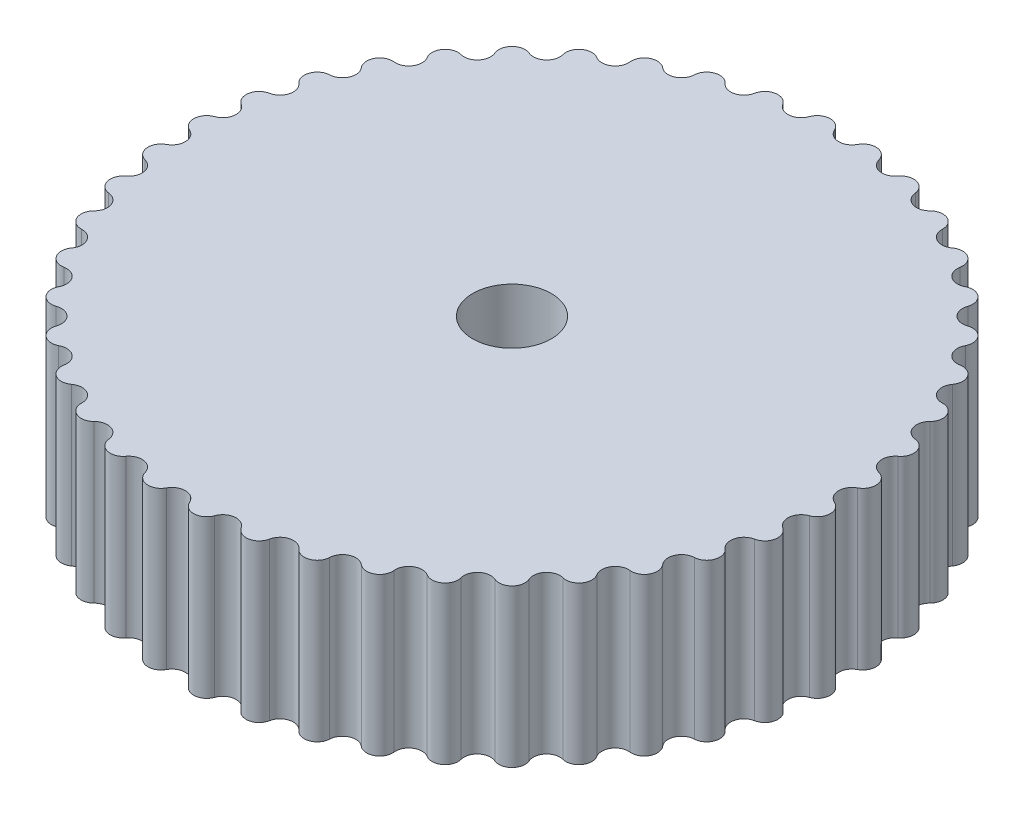
from build123d import *

# Parameters (mm, degrees)
BOSS_EXTRUDE1_DEPTH = 5
CIRPATTERN1_COUNT   = 42


with BuildPart() as part:
    # Sketch1 → Boss-Extrude1 (new body)
    with BuildSketch(Plane(origin=(0, 0, 0), x_dir=(1, 0, 0), z_dir=(0, 1, 0))):
        with BuildLine():
            Line((0, 10.25), (0, 1.25))
            ThreePointArc((0, 1.25), (0.093412617, 1.246504746), (0.186302833, 1.236038533))
            Line((0.186302833, 1.236038533), (1.527683228, 10.135515969))
            ThreePointArc((1.527683228, 10.135515969), (1.175626999, 10.433978204), (0.765983459, 10.221338921))
            ThreePointArc((0.765983459, 10.221338921), (0.373911943, 9.993007048), (0, 10.25))
        make_face()
    boss_extrude1 = extrude(amount=BOSS_EXTRUDE1_DEPTH)

    # CirPattern1: Boss-Extrude1 ×42 about axis
    cirpattern1_axis = Axis((0, 0, 0), (0, -1, 0))
    for i in range(1, CIRPATTERN1_COUNT):
        add(boss_extrude1.rotate(cirpattern1_axis, i * 360 / CIRPATTERN1_COUNT))


solid = part.part
